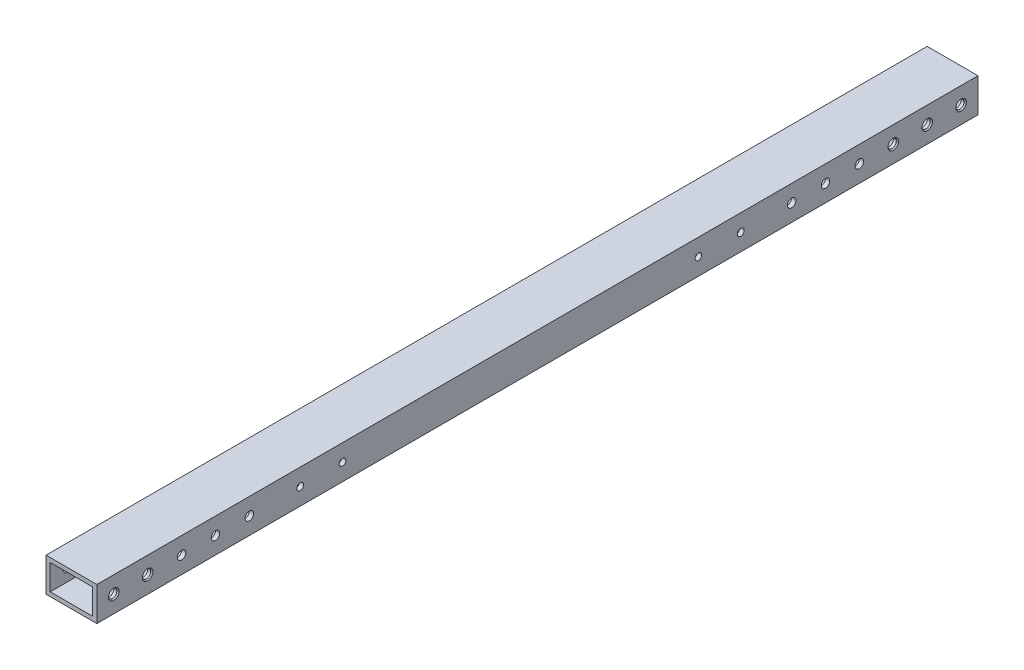
from build123d import *

# Parameters (mm, degrees)
BOSS_EXTRUDE1_DEPTH                  = 330.200001
BOSS_EXTRUDE1_DEPTH_BACK             = 330.200001
SKETCH3_W                            = 38.1
SKETCH3_H                            = 25.4
SKETCH3_W_2                          = 31.75
SKETCH3_H_2                          = 19.05
F_1_4_0_25_DIAMETER_HOLE2_AT_2_COUNT = 2
F_1_4_0_25_DIAMETER_HOLE2_AT_2_PITCH = 25.4
F_1_4_0_25_DIAMETER_HOLE2_AT_3_COUNT = 2
F_1_4_0_25_DIAMETER_HOLE2_AT_3_PITCH = 635.000000508
F_1_4_0_25_DIAMETER_HOLE2_AT_4_COUNT = 2
F_1_4_0_25_DIAMETER_HOLE2_AT_4_PITCH = 50.8
F_1_4_0_25_DIAMETER_HOLE2_AT_5_COUNT = 2
F_1_4_0_25_DIAMETER_HOLE2_AT_5_PITCH = 609.600000508
F_1_4_0_25_DIAMETER_HOLE3_D          = 6.35
F_13_64_0_20313_DIAMETER_HOLE1_D     = 5.159502
F_10_CLEARANCE_HOLE1_D               = 4.9784


with BuildPart() as part:
    # Sketch3 → Boss-Extrude1 (new, two sides: drawn at the far end of the back side and taken through both)
    with BuildSketch(Plane.XY.offset(-BOSS_EXTRUDE1_DEPTH_BACK)):
        Rectangle(SKETCH3_W, SKETCH3_H)
        Rectangle(SKETCH3_W_2, SKETCH3_H_2, mode=Mode.SUBTRACT)
    extrude(amount=BOSS_EXTRUDE1_DEPTH + BOSS_EXTRUDE1_DEPTH_BACK)

    # Sketch8 → 1/4 (0.25) Diameter Hole2 (revolve, cut)
    with BuildSketch(Plane(origin=(-19.05, 0, -317.500000508), x_dir=(0, 0, 1), z_dir=(0, 1, 0))):
        Polygon((0, 0), (0, 38.1), (3.9624, 38.1), (3.175, 37.194199916), (3.175, 0), align=None)
    f_1_4_0_25_diameter_hole2 = revolve(axis=Axis((-25.4, 0, -317.500000508), (1, 0, 0)), mode=Mode.SUBTRACT)

    # 1/4 (0.25) Diameter Hole2 at 2: 1/4 (0.25) Diameter Hole2 ×2
    with Locations(*[(0, 0, i * F_1_4_0_25_DIAMETER_HOLE2_AT_2_PITCH) for i in range(1, F_1_4_0_25_DIAMETER_HOLE2_AT_2_COUNT)]):
        add(f_1_4_0_25_diameter_hole2, mode=Mode.SUBTRACT)

    # 1/4 (0.25) Diameter Hole2 at 3: 1/4 (0.25) Diameter Hole2 ×2
    with Locations(*[(0, 0, i * F_1_4_0_25_DIAMETER_HOLE2_AT_3_PITCH) for i in range(1, F_1_4_0_25_DIAMETER_HOLE2_AT_3_COUNT)]):
        add(f_1_4_0_25_diameter_hole2, mode=Mode.SUBTRACT)

    # 1/4 (0.25) Diameter Hole2 at 4: 1/4 (0.25) Diameter Hole2 ×2
    with Locations(*[(0, 0, i * F_1_4_0_25_DIAMETER_HOLE2_AT_4_PITCH) for i in range(1, F_1_4_0_25_DIAMETER_HOLE2_AT_4_COUNT)]):
        add(f_1_4_0_25_diameter_hole2, mode=Mode.SUBTRACT)

    # 1/4 (0.25) Diameter Hole2 at 5: 1/4 (0.25) Diameter Hole2 ×2
    with Locations(*[(0, 0, i * F_1_4_0_25_DIAMETER_HOLE2_AT_5_PITCH) for i in range(1, F_1_4_0_25_DIAMETER_HOLE2_AT_5_COUNT)]):
        add(f_1_4_0_25_diameter_hole2, mode=Mode.SUBTRACT)

    # 1/4 (0.25) Diameter Hole3 (through all)
    with Locations(Plane(origin=(19.05, 0, 0), x_dir=(0, 0, -1), z_dir=(1, 0, 0))):
        with Locations((-266.7, 0), (-241.3, 0), (-215.9, 0), (241.300000508, 0), (215.900000508, 0), (190.500000508, 0)):
            Hole(F_1_4_0_25_DIAMETER_HOLE3_D / 2)

    # 13/64 (0.20313) Diameter Hole1 (through all)
    with Locations(Plane(origin=(19.05, 0, 0), x_dir=(0, 0, -1), z_dir=(1, 0, 0))):
        with Locations((152.4, 0), (-177.8, 0)):
            Hole(F_13_64_0_20313_DIAMETER_HOLE1_D / 2)

    # #10 Clearance Hole1 (through all)
    with Locations(Plane.ZY.offset(19.05)):
        with Locations((-120.650000508, 0), (146.05, 0)):
            Hole(F_10_CLEARANCE_HOLE1_D / 2)


solid = part.part
